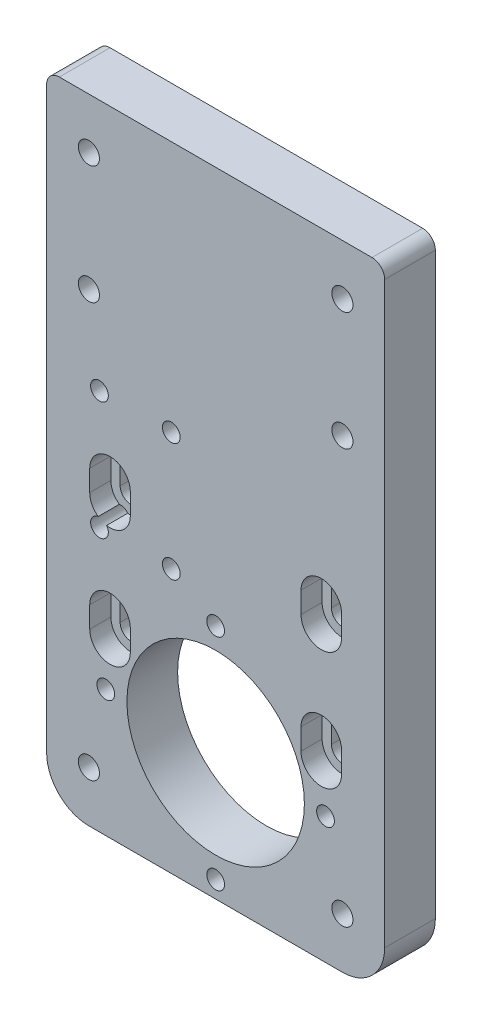
from build123d import *

# Parameters (mm, degrees)
SKETCH_6_W                  = 80
SKETCH_6_H                  = 150
EXTRUDE_1_DEPTH             = 12
SKETCH_8_R                  = 21
CUT_EXTRUDE_1_DEPTH         = 171.423003142
FILLET_1_R                  = 10
HOLE_WIZARD_M5_1_D          = 4.2
PATTERN_CIRCULAR_1_COUNT    = 4
CUT_EXTRUDE_2_DEPTH         = 171.423003142
CUT_EXTRUDE_3_DEPTH         = 5
FILLET_2_R                  = 3
PATTERN_LINEAR_1_COUNT      = 2
PATTERN_LINEAR_1_PITCH      = 28
PATTERN_LINEAR_1_COUNT_DIR2 = 2
PATTERN_LINEAR_1_PITCH_DIR2 = 50
HOLE_WIZARD_M6_1_AT_2_COUNT = 2
HOLE_WIZARD_M6_1_AT_2_PITCH = 98
HOLE_WIZARD_M6_1_AT_3_COUNT = 2
HOLE_WIZARD_M6_1_AT_3_PITCH = 126
HOLE_WIZARD_M5_2_D          = 4.2


with BuildPart() as part:
    # 草图6 → 凸台-拉伸1 (new body)
    with BuildSketch(Plane.XY):
        with Locations((40, 75)):
            Rectangle(SKETCH_6_W, SKETCH_6_H)
    extrude(amount=EXTRUDE_1_DEPTH)

    # 草图8 → 切除-拉伸1 (cut, through all)
    with BuildSketch(Plane.XY.offset(12)):
        with Locations((40, 30)):
            Circle(SKETCH_8_R)
    extrude(amount=-CUT_EXTRUDE_1_DEPTH, mode=Mode.SUBTRACT)

    # 圆角1
    fillet_1_edges = [part.edges().sort_by_distance(p)[0] for p in [
        (80, 0, 6),
        (0, 0, 6),
    ]]
    fillet(fillet_1_edges, radius=FILLET_1_R)

    # M5 螺纹孔1 (through all)
    with Locations(Plane.XY.offset(12)):
        with Locations((40, 56)):
            hole_wizard_m5_1 = Hole(HOLE_WIZARD_M5_1_D / 2)

    # 阵列(圆周)1: M5 螺纹孔1 ×4 about axis
    pattern_circular_1_axis = Axis((40, 30, 0), (0, 0, 1))
    for i in range(1, PATTERN_CIRCULAR_1_COUNT):
        add(hole_wizard_m5_1.rotate(pattern_circular_1_axis, i * 360 / PATTERN_CIRCULAR_1_COUNT), mode=Mode.SUBTRACT)

    # 草图11 → 切除-拉伸2 (cut, through all)
    with BuildSketch(Plane.XY.offset(12)):
        with BuildLine():
            Line((62.4, 68.414091782), (62.4, 73.414091782))
            ThreePointArc((62.4, 73.414091782), (65, 76.014091782), (67.6, 73.414091782))
            Line((67.6, 73.414091782), (67.6, 68.414091782))
            ThreePointArc((67.6, 68.414091782), (65, 65.814091782), (62.4, 68.414091782))
        make_face()
    cut_extrude_2 = extrude(amount=-CUT_EXTRUDE_2_DEPTH, mode=Mode.SUBTRACT)

    # 草图12 → 切除-拉伸3 (cut)
    with BuildSketch(Plane.XY.offset(12)):
        with BuildLine():
            Line((60.2, 68.414091782), (60.2, 73.414091782))
            ThreePointArc((60.2, 73.414091782), (65, 78.214091782), (69.8, 73.414091782))
            Line((69.8, 73.414091782), (69.8, 68.414091782))
            ThreePointArc((69.8, 68.414091782), (65, 63.614091782), (60.2, 68.414091782))
        make_face()
    cut_extrude_3 = extrude(amount=-CUT_EXTRUDE_3_DEPTH, mode=Mode.SUBTRACT)

    # 圆角2
    fillet_2_edges = [part.edges().sort_by_distance(p)[0] for p in [
        (0, 150, 6),
        (80, 150, 6),
    ]]
    fillet(fillet_2_edges, radius=FILLET_2_R)

    # 阵列(线性)1: 切除-拉伸2, Cut-Extrude 3 2 × 2
    with Locations(*[(-j * PATTERN_LINEAR_1_PITCH_DIR2, -i * PATTERN_LINEAR_1_PITCH, 0) for i in range(PATTERN_LINEAR_1_COUNT) for j in range(PATTERN_LINEAR_1_COUNT_DIR2) if (i, j) != (0, 0)]):
        add(cut_extrude_2, mode=Mode.SUBTRACT)
        add(cut_extrude_3, mode=Mode.SUBTRACT)

    # 草图13 → M6 螺纹孔1 (revolve, cut)
    with BuildSketch(Plane(origin=(70, 12, 12), x_dir=(0, -1, 0), z_dir=(1, 0, 0))):
        Polygon((0, 0), (0, 16.502151548), (2.5, 15), (2.5, 0), align=None)
    hole_wizard_m6_1 = revolve(axis=Axis((70, 12, 18.35), (0, 0, -1)), mode=Mode.SUBTRACT)

    # M6 螺纹孔1 at 2: M6 螺纹孔1 ×2
    with Locations(*[(0, i * HOLE_WIZARD_M6_1_AT_2_PITCH, 0) for i in range(1, HOLE_WIZARD_M6_1_AT_2_COUNT)]):
        add(hole_wizard_m6_1, mode=Mode.SUBTRACT)

    # M6 螺纹孔1 at 3: M6 螺纹孔1 ×2
    with Locations(*[(0, i * HOLE_WIZARD_M6_1_AT_3_PITCH, 0) for i in range(1, HOLE_WIZARD_M6_1_AT_3_COUNT)]):
        add(hole_wizard_m6_1, mode=Mode.SUBTRACT)

    # 镜向1: M6 螺纹孔1 across plane
    add(hole_wizard_m6_1.mirror(Plane.ZY.offset(-40)), mode=Mode.SUBTRACT)

    # 镜向1 copy 1 sketch → 镜向1 copy 1 (revolve, cut)
    with BuildSketch(Plane(origin=(10, 110, 12), x_dir=(0, -1, 0), z_dir=(-1, 0, 0))):
        Polygon((0, 0), (0, -16.502151548), (2.5, -15), (2.5, 0), align=None)
    revolve(axis=Axis((10, 110, 18.35), (0, 0, 1)), mode=Mode.SUBTRACT)

    # 镜向1 copy 2 sketch → 镜向1 copy 2 (revolve, cut)
    with BuildSketch(Plane(origin=(10, 138, 12), x_dir=(0, -1, 0), z_dir=(-1, 0, 0))):
        Polygon((0, 0), (0, -16.502151548), (2.5, -15), (2.5, 0), align=None)
    revolve(axis=Axis((10, 138, 18.35), (0, 0, 1)), mode=Mode.SUBTRACT)

    # M5 螺纹孔2 (through all)
    with Locations(Plane(origin=(0, 0, 0), x_dir=(-1, 0, 0), z_dir=(0, 0, -1))):
        with Locations((-12.5, 62.435602505), (-29.5, 62.435602505), (-29.5, 90.435602505), (-12.5, 90.435602505)):
            Hole(HOLE_WIZARD_M5_2_D / 2)


solid = part.part
